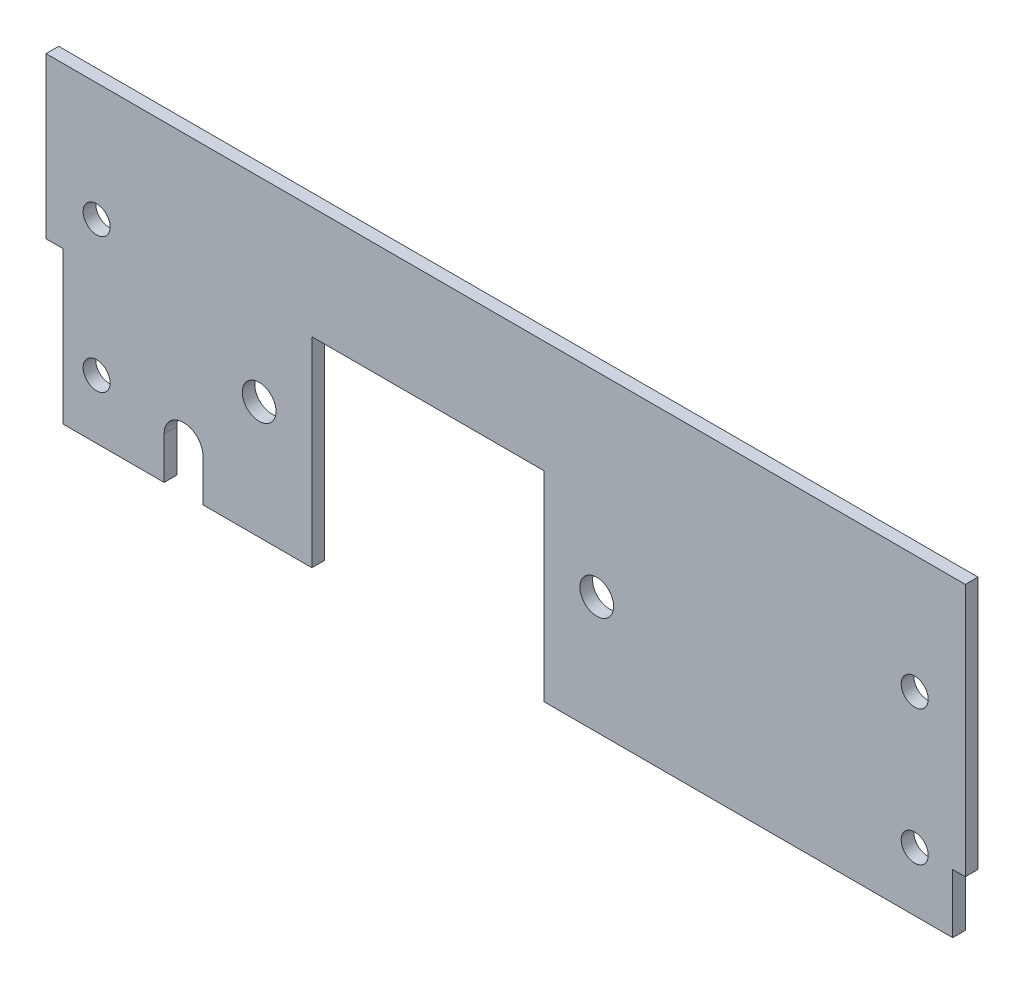
from build123d import *

# Parameters (mm, degrees)
SKETCH1_W           = 110.914742868
SKETCH1_H           = 37
SKETCH1_R           = 1.6
BOSS_EXTRUDE1_DEPTH = 1.5
SKETCH2_W           = 3
SKETCH2_H           = 18
CUT_EXTRUDE1_DEPTH  = 1.5
SKETCH3_W           = 1.5
SKETCH3_H           = 7
SKETCH3_W_2         = 1
SKETCH3_H_2         = 30
SKETCH3_H_3         = 19
CUT_EXTRUDE2_DEPTH  = 10
SKETCH4_R           = 2
SKETCH4_W           = 27.5
SKETCH4_H           = 23.7
CUT_EXTRUDE3_DEPTH  = 10


with BuildPart() as part:
    # Sketch1 → Boss-Extrude1 (new body)
    with BuildSketch(Plane.XY):
        with Locations((55.457371434, 579.580871166)):
            Rectangle(SKETCH1_W, SKETCH1_H)
        with Locations((103.914742868, 584.080871166)):
            Circle(SKETCH1_R, mode=Mode.SUBTRACT)
        with Locations((103.914742868, 568.080871166)):
            Circle(SKETCH1_R, mode=Mode.SUBTRACT)
        with Locations((7, 584.080871166)):
            Circle(SKETCH1_R, mode=Mode.SUBTRACT)
        with Locations((7, 568.080871166)):
            Circle(SKETCH1_R, mode=Mode.SUBTRACT)
    extrude(amount=BOSS_EXTRUDE1_DEPTH)

    # Sketch2 → Cut-Extrude1 (cut)
    with BuildSketch(Plane.XY.offset(1.5)):
        with Locations((1.5, 570.080871166)):
            Rectangle(SKETCH2_W, SKETCH2_H)
    extrude(amount=-CUT_EXTRUDE1_DEPTH, mode=Mode.SUBTRACT)

    # Sketch3 → Cut-Extrude2 (cut)
    with BuildSketch(Plane.XY.offset(1.5)):
        with Locations((109.164742868, 564.580871166)):
            Rectangle(SKETCH3_W, SKETCH3_H)
        with Locations((110.414742868, 564.580871166)):
            Rectangle(SKETCH3_W_2, SKETCH3_H)
        with Locations((110.414742868, 583.080871166)):
            Rectangle(SKETCH3_W_2, SKETCH3_H_2)
        with Locations((0.5, 588.580871166)):
            Rectangle(SKETCH3_W_2, SKETCH3_H_3)
    extrude(amount=-CUT_EXTRUDE2_DEPTH, mode=Mode.SUBTRACT)

    # Sketch4 → Cut-Extrude3 (cut)
    with BuildSketch(Plane.XY.offset(1.5)):
        with Locations((66.25, 574.980871166)):
            Circle(SKETCH4_R)
        with Locations((26.25, 574.980871166)):
            Circle(SKETCH4_R)
        with Locations((46.25, 572.930871166)):
            Rectangle(SKETCH4_W, SKETCH4_H)
        with BuildLine():
            Line((15, 561.080871166), (15, 566.080871166))
            ThreePointArc((15, 566.080871166), (17.3, 568.380871166), (19.6, 566.080871166))
            Line((19.6, 566.080871166), (19.6, 561.080871166))
            ThreePointArc((19.6, 561.080871166), (17.3, 558.780871166), (15, 561.080871166))
        make_face()
    extrude(amount=-CUT_EXTRUDE3_DEPTH, mode=Mode.SUBTRACT)


solid = part.part
